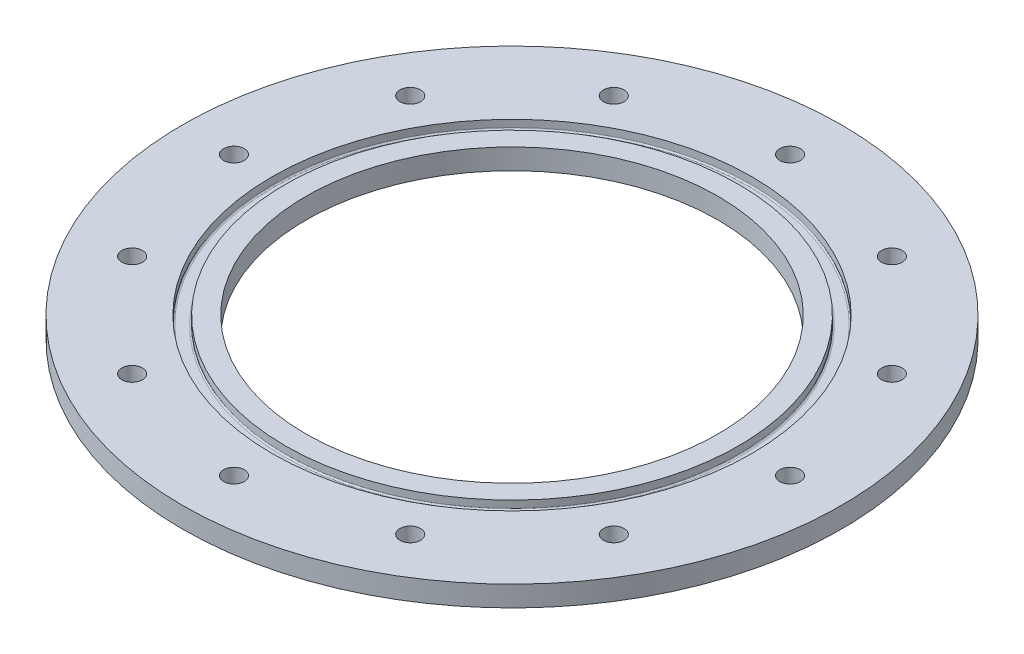
from build123d import *

# Parameters (mm, degrees)
SKETCH1_R           = 101.6
BOSS_EXTRUDE1_DEPTH = 6.35
SKETCH2_R           = 63.5
CUT_EXTRUDE1_DEPTH  = 144.824345992
CUT_EXTRUDE2_REACH  = 145.824
SKETCH3_R           = 3.175
SKETCH4_R           = 73.9394
SKETCH4_R_2         = 69.85
CUT_EXTRUDE3_DEPTH  = 2.6416
FILLET1_R           = 0.4318


with BuildPart() as part:
    # Sketch1 → Boss-Extrude1 (new body)
    with BuildSketch(Plane(origin=(0, 0, 0), x_dir=(1, 0, 0), z_dir=(0, 1, 0))):
        with Locations(Location((0, 0, 0), (0, 0, 270))):
            Circle(SKETCH1_R)
    extrude(amount=BOSS_EXTRUDE1_DEPTH)

    # Sketch2 → Cut-Extrude1 (cut, through all)
    with BuildSketch(Plane(origin=(0, 6.35, 0), x_dir=(1, 0, 0), z_dir=(0, 1, 0))):
        with Locations(Location((0, 0, 0), (0, 0, 270))):
            Circle(SKETCH2_R)
    extrude(amount=-CUT_EXTRUDE1_DEPTH, mode=Mode.SUBTRACT)

    # Sketch3 → Cut-Extrude2 (cut, up to next)
    with BuildSketch(Plane(origin=(0, 6.35, 0), x_dir=(1, 0, 0), z_dir=(0, 1, 0)), mode=Mode.PRIVATE) as cut_extrude2_sk1:
        with Locations(Location((0, 85.725, 0), (0, 0, 270))):
            Circle(SKETCH3_R)
    cut_extrude2_tool1 = extrude(cut_extrude2_sk1.sketch, amount=-CUT_EXTRUDE2_REACH, mode=Mode.PRIVATE) & part.part
    # Sketch3 → Cut-Extrude2 (cut, up to next)
    with BuildSketch(Plane(origin=(0, 6.35, 0), x_dir=(1, 0, 0), z_dir=(0, 1, 0)), mode=Mode.PRIVATE) as cut_extrude2_sk2:
        with Locations(Location((42.8625, 74.240027739, 0), (0, 0, 270))):
            Circle(SKETCH3_R)
    cut_extrude2_tool2 = extrude(cut_extrude2_sk2.sketch, amount=-CUT_EXTRUDE2_REACH, mode=Mode.PRIVATE) & part.part
    # Sketch3 → Cut-Extrude2 (cut, up to next)
    with BuildSketch(Plane(origin=(0, 6.35, 0), x_dir=(1, 0, 0), z_dir=(0, 1, 0)), mode=Mode.PRIVATE) as cut_extrude2_sk3:
        with Locations(Location((74.240027739, 42.8625, 0), (0, 0, 270))):
            Circle(SKETCH3_R)
    cut_extrude2_tool3 = extrude(cut_extrude2_sk3.sketch, amount=-CUT_EXTRUDE2_REACH, mode=Mode.PRIVATE) & part.part
    # Sketch3 → Cut-Extrude2 (cut, up to next)
    with BuildSketch(Plane(origin=(0, 6.35, 0), x_dir=(1, 0, 0), z_dir=(0, 1, 0)), mode=Mode.PRIVATE) as cut_extrude2_sk4:
        with Locations(Location((85.725, 0, 0), (0, 0, 270))):
            Circle(SKETCH3_R)
    cut_extrude2_tool4 = extrude(cut_extrude2_sk4.sketch, amount=-CUT_EXTRUDE2_REACH, mode=Mode.PRIVATE) & part.part
    # Sketch3 → Cut-Extrude2 (cut, up to next)
    with BuildSketch(Plane(origin=(0, 6.35, 0), x_dir=(1, 0, 0), z_dir=(0, 1, 0)), mode=Mode.PRIVATE) as cut_extrude2_sk5:
        with Locations(Location((74.240027739, -42.8625, 0), (0, 0, 270))):
            Circle(SKETCH3_R)
    cut_extrude2_tool5 = extrude(cut_extrude2_sk5.sketch, amount=-CUT_EXTRUDE2_REACH, mode=Mode.PRIVATE) & part.part
    # Sketch3 → Cut-Extrude2 (cut, up to next)
    with BuildSketch(Plane(origin=(0, 6.35, 0), x_dir=(1, 0, 0), z_dir=(0, 1, 0)), mode=Mode.PRIVATE) as cut_extrude2_sk6:
        with Locations(Location((42.8625, -74.240027739, 0), (0, 0, 270))):
            Circle(SKETCH3_R)
    cut_extrude2_tool6 = extrude(cut_extrude2_sk6.sketch, amount=-CUT_EXTRUDE2_REACH, mode=Mode.PRIVATE) & part.part
    # Sketch3 → Cut-Extrude2 (cut, up to next)
    with BuildSketch(Plane(origin=(0, 6.35, 0), x_dir=(1, 0, 0), z_dir=(0, 1, 0)), mode=Mode.PRIVATE) as cut_extrude2_sk7:
        with Locations(Location((0, -85.725, 0), (0, 0, 270))):
            Circle(SKETCH3_R)
    cut_extrude2_tool7 = extrude(cut_extrude2_sk7.sketch, amount=-CUT_EXTRUDE2_REACH, mode=Mode.PRIVATE) & part.part
    # Sketch3 → Cut-Extrude2 (cut, up to next)
    with BuildSketch(Plane(origin=(0, 6.35, 0), x_dir=(1, 0, 0), z_dir=(0, 1, 0)), mode=Mode.PRIVATE) as cut_extrude2_sk8:
        with Locations(Location((-42.8625, -74.240027739, 0), (0, 0, 270))):
            Circle(SKETCH3_R)
    cut_extrude2_tool8 = extrude(cut_extrude2_sk8.sketch, amount=-CUT_EXTRUDE2_REACH, mode=Mode.PRIVATE) & part.part
    # Sketch3 → Cut-Extrude2 (cut, up to next)
    with BuildSketch(Plane(origin=(0, 6.35, 0), x_dir=(1, 0, 0), z_dir=(0, 1, 0)), mode=Mode.PRIVATE) as cut_extrude2_sk9:
        with Locations(Location((-74.240027739, -42.8625, 0), (0, 0, 270))):
            Circle(SKETCH3_R)
    cut_extrude2_tool9 = extrude(cut_extrude2_sk9.sketch, amount=-CUT_EXTRUDE2_REACH, mode=Mode.PRIVATE) & part.part
    # Sketch3 → Cut-Extrude2 (cut, up to next)
    with BuildSketch(Plane(origin=(0, 6.35, 0), x_dir=(1, 0, 0), z_dir=(0, 1, 0)), mode=Mode.PRIVATE) as cut_extrude2_sk10:
        with Locations(Location((-85.725, 0, 0), (0, 0, 270))):
            Circle(SKETCH3_R)
    cut_extrude2_tool10 = extrude(cut_extrude2_sk10.sketch, amount=-CUT_EXTRUDE2_REACH, mode=Mode.PRIVATE) & part.part
    # Sketch3 → Cut-Extrude2 (cut, up to next)
    with BuildSketch(Plane(origin=(0, 6.35, 0), x_dir=(1, 0, 0), z_dir=(0, 1, 0)), mode=Mode.PRIVATE) as cut_extrude2_sk11:
        with Locations(Location((-74.240027739, 42.8625, 0), (0, 0, 270))):
            Circle(SKETCH3_R)
    cut_extrude2_tool11 = extrude(cut_extrude2_sk11.sketch, amount=-CUT_EXTRUDE2_REACH, mode=Mode.PRIVATE) & part.part
    # Sketch3 → Cut-Extrude2 (cut, up to next)
    with BuildSketch(Plane(origin=(0, 6.35, 0), x_dir=(1, 0, 0), z_dir=(0, 1, 0)), mode=Mode.PRIVATE) as cut_extrude2_sk12:
        with Locations(Location((-42.8625, 74.240027739, 0), (0, 0, 270))):
            Circle(SKETCH3_R)
    cut_extrude2_tool12 = extrude(cut_extrude2_sk12.sketch, amount=-CUT_EXTRUDE2_REACH, mode=Mode.PRIVATE) & part.part
    add(cut_extrude2_tool1.solids().sort_by_distance((0, 6.35, -85.725))[0], mode=Mode.SUBTRACT)
    add(cut_extrude2_tool2.solids().sort_by_distance((42.8625, 6.35, -74.240028))[0], mode=Mode.SUBTRACT)
    add(cut_extrude2_tool3.solids().sort_by_distance((74.240028, 6.35, -42.8625))[0], mode=Mode.SUBTRACT)
    add(cut_extrude2_tool4.solids().sort_by_distance((85.725, 6.35, 0))[0], mode=Mode.SUBTRACT)
    add(cut_extrude2_tool5.solids().sort_by_distance((74.240028, 6.35, 42.8625))[0], mode=Mode.SUBTRACT)
    add(cut_extrude2_tool6.solids().sort_by_distance((42.8625, 6.35, 74.240028))[0], mode=Mode.SUBTRACT)
    add(cut_extrude2_tool7.solids().sort_by_distance((0, 6.35, 85.725))[0], mode=Mode.SUBTRACT)
    add(cut_extrude2_tool8.solids().sort_by_distance((-42.8625, 6.35, 74.240028))[0], mode=Mode.SUBTRACT)
    add(cut_extrude2_tool9.solids().sort_by_distance((-74.240028, 6.35, 42.8625))[0], mode=Mode.SUBTRACT)
    add(cut_extrude2_tool10.solids().sort_by_distance((-85.725, 6.35, 0))[0], mode=Mode.SUBTRACT)
    add(cut_extrude2_tool11.solids().sort_by_distance((-74.240028, 6.35, -42.8625))[0], mode=Mode.SUBTRACT)
    add(cut_extrude2_tool12.solids().sort_by_distance((-42.8625, 6.35, -74.240028))[0], mode=Mode.SUBTRACT)

    # Sketch4 → Cut-Extrude3 (cut)
    with BuildSketch(Plane(origin=(0, 6.35, 0), x_dir=(1, 0, 0), z_dir=(0, 1, 0))):
        with Locations(Location((0, 0, 0), (0, 0, 270))):
            Circle(SKETCH4_R)
        with Locations(Location((0, 0, 0), (0, 0, 270))):
            Circle(SKETCH4_R_2, mode=Mode.SUBTRACT)
    extrude(amount=-CUT_EXTRUDE3_DEPTH, mode=Mode.SUBTRACT)

    # Fillet1
    fillet1_edges = [part.edges().sort_by_distance(p)[0] for p in [
        (0, 3.7084, -73.9394),
        (0, 3.7084, -69.85),
    ]]
    fillet(fillet1_edges, radius=FILLET1_R)


solid = part.part
